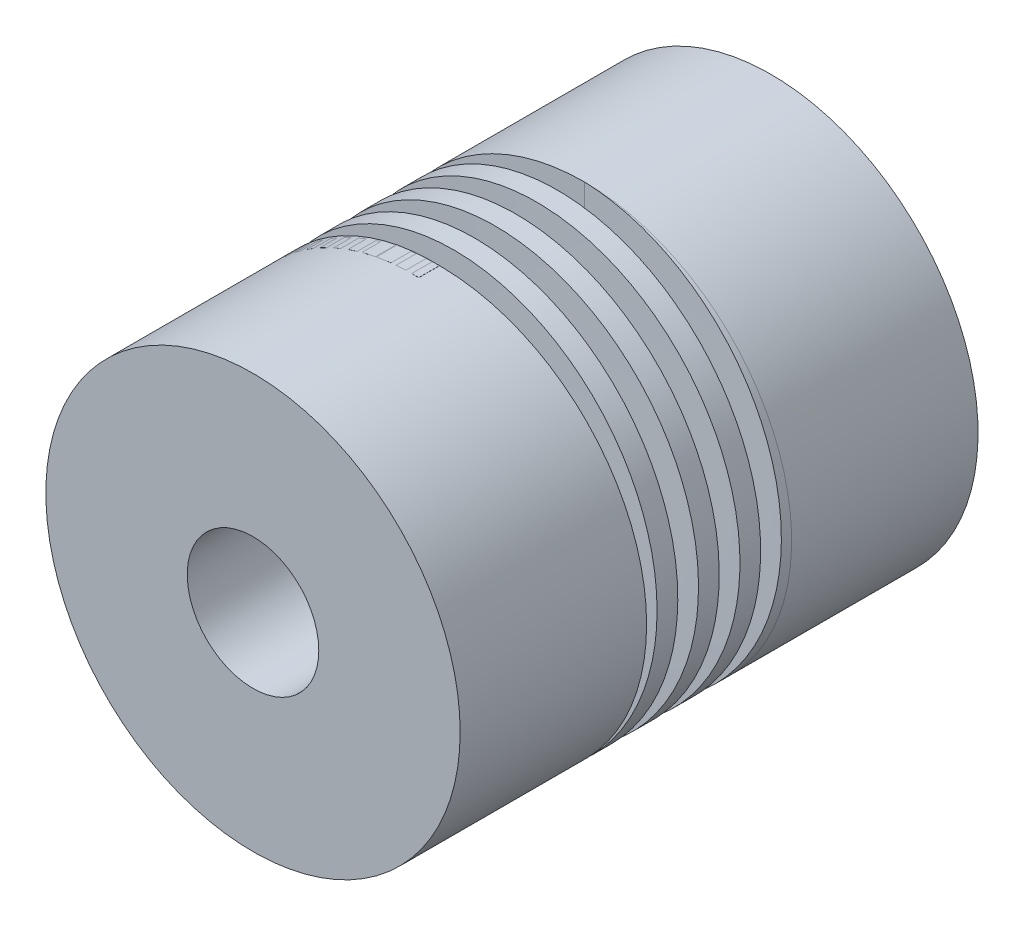
from build123d import *

# Parameters (mm, degrees)
SKETCH1_R           = 10
SKETCH1_R_2         = 3.175
BOSS_EXTRUDE1_DEPTH = 9
SKETCH6_R           = 10
SKETCH6_R_2         = 2.5
BOSS_EXTRUDE2_DEPTH = 9
SKETCH3_W           = 1
SKETCH3_H           = 6
SKETCH11_R          = 4
CUT_EXTRUDE1_DEPTH  = 2


with BuildPart() as part:
    # Sketch1 → Boss-Extrude1 (new body)
    with BuildSketch(Plane.XY):
        Circle(SKETCH1_R)
        Circle(SKETCH1_R_2, mode=Mode.SUBTRACT)
    extrude(amount=-BOSS_EXTRUDE1_DEPTH)


with BuildPart() as body_2:
    # Sketch6 → Boss-Extrude2 (new body)
    with BuildSketch(Plane(origin=(0, 0, -16), x_dir=(-1, 0, 0), z_dir=(0, 0, -1))):
        Circle(SKETCH6_R)
        Circle(SKETCH6_R_2, mode=Mode.SUBTRACT)
    extrude(amount=BOSS_EXTRUDE2_DEPTH)

    # Sweep2: sweep along a curve in space
    with BuildLine() as sweep2_path:
        add(Edge.make_bspline(
            [(0, 7, -9), (-0.910434, 7, -9.0414), (-2.751188, 6.635523, -9.125124), (-5.077896, 5.07861, -9.249967), (-6.635714, 2.748524, -9.375009), (-7.182187, 0, -9.499998), (-6.635537, -2.748524, -9.625001), (-5.078606, -5.07861, -9.75), (-2.748525, -6.635523, -9.875), (0, -7.182238, -10), (2.748524, -6.635523, -10.125), (5.07861, -5.07861, -10.25), (6.635523, -2.748524, -10.375), (7.182238, 0, -10.5), (6.635523, 2.748524, -10.625), (5.07861, 5.07861, -10.75), (2.748524, 6.635523, -10.875), (0, 7.182238, -11), (-2.748524, 6.635523, -11.125), (-5.07861, 5.07861, -11.25), (-6.635523, 2.748524, -11.375), (-7.182238, 0, -11.5), (-6.635523, -2.748524, -11.625), (-5.07861, -5.07861, -11.75), (-2.748524, -6.635523, -11.875), (0, -7.182238, -12), (2.748524, -6.635523, -12.125), (5.07861, -5.07861, -12.25), (6.635523, -2.748524, -12.375), (7.182238, 0, -12.5), (6.635523, 2.748524, -12.625), (5.07861, 5.07861, -12.75), (2.748524, 6.635523, -12.875), (0, 7.182238, -13), (-2.748524, 6.635523, -13.125), (-5.07861, 5.07861, -13.25), (-6.635523, 2.748524, -13.375), (-7.182238, 0, -13.5), (-6.635523, -2.748524, -13.625), (-5.07861, -5.07861, -13.75), (-2.748524, -6.635523, -13.875), (0, -7.182238, -14), (2.748524, -6.635523, -14.125), (5.07861, -5.07861, -14.25), (6.635523, -2.748524, -14.375), (7.182238, 0, -14.5), (6.635523, 2.748524, -14.625), (5.07861, 5.07861, -14.75), (2.748524, 6.635523, -14.875), (0, 7.182238, -15), (-2.748524, 6.635523, -15.125), (-5.07861, 5.07861, -15.25), (-6.635523, 2.748524, -15.375), (-7.182238, 0, -15.5), (-6.635523, -2.748524, -15.625), (-5.07861, -5.07861, -15.75), (-2.748524, -6.635523, -15.875), (0, -7.182238, -16), (2.748525, -6.635523, -16.125), (5.078606, -5.07861, -16.25), (6.635537, -2.748524, -16.374999), (7.182187, 0, -16.500002), (6.635714, 2.748524, -16.624991), (5.077896, 5.07861, -16.750033), (2.751188, 6.635523, -16.874876), (0.910434, 7, -16.9586), (0, 7, -17)],
            knots=[0, 0, 0, 0, 0.015625, 0.03125, 0.046875, 0.0625, 0.078125, 0.09375, 0.109375, 0.125, 0.140625, 0.15625, 0.171875, 0.1875, 0.203125, 0.21875, 0.234375, 0.25, 0.265625, 0.28125, 0.296875, 0.3125, 0.328125, 0.34375, 0.359375, 0.375, 0.390625, 0.40625, 0.421875, 0.4375, 0.453125, 0.46875, 0.484375, 0.5, 0.515625, 0.53125, 0.546875, 0.5625, 0.578125, 0.59375, 0.609375, 0.625, 0.640625, 0.65625, 0.671875, 0.6875, 0.703125, 0.71875, 0.734375, 0.75, 0.765625, 0.78125, 0.796875, 0.8125, 0.828125, 0.84375, 0.859375, 0.875, 0.890625, 0.90625, 0.921875, 0.9375, 0.953125, 0.96875, 0.984375, 1, 1, 1, 1], degree=3))
    with BuildLine() as sweep2_axis:
        Line((0, 0, -9), (0, 0, -17))
    # Sketch3 → Sweep2 (sweep)
    with BuildSketch(Plane(origin=(0, 0, 0), x_dir=(0, 0, -1), z_dir=(1, 0, 0))):
        with Locations((8.5, 7)):
            Rectangle(SKETCH3_W, SKETCH3_H)
    sweep(path=sweep2_path.line, binormal=sweep2_axis.edges()[0])

    # Sketch11 → Cut-Extrude1 (cut)
    with BuildSketch(Plane(origin=(0, 0, -16), x_dir=(-1, 0, 0), z_dir=(0, 0, -1))):
        with Locations(Location((0, 0, 0), (0, 0, 270))):
            Circle(SKETCH11_R)
    extrude(amount=CUT_EXTRUDE1_DEPTH, mode=Mode.SUBTRACT)


solid = Compound([part.part, body_2.part])
